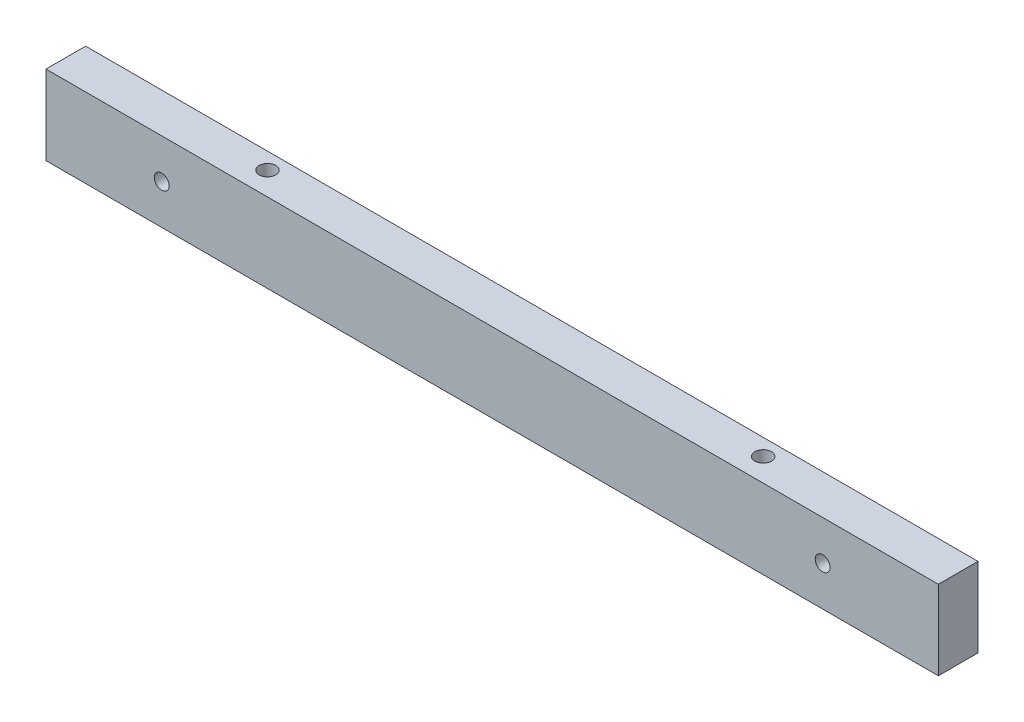
from build123d import *

# Parameters (mm, degrees)
ESQUISSE1_W             = 639
ESQUISSE1_H             = 48
BOSS_EXTRU_1_DEPTH      = 24
ENL_V_MAT_EXTRU_1_DEPTH = 322.297759096
ESQUISSE3_R             = 4.5
ENL_V_MAT_EXTRU_2_DEPTH = 322.297759096
ESQUISSE5_R             = 5
ENL_V_MAT_EXTRU_4_DEPTH = 324.975693533
ENL_V_MAT_EXTRU_5_DEPTH = 322.297759096


with BuildPart() as part:
    # Esquisse1 → Boss.-Extru.1 (new body)
    with BuildSketch(Plane.XY):
        Rectangle(ESQUISSE1_W, ESQUISSE1_H)
    extrude(amount=BOSS_EXTRU_1_DEPTH)

    # Esquisse2 → Enlèv. mat.-Extru.1 (cut, through all)
    with BuildSketch(Plane.XY.offset(24)):
        Polygon((-319.5, 24), (-271.5, -24), (-319.5, -24), align=None)
        Polygon((319.5, 24), (271.5, -24), (319.5, -24), align=None)
    extrude(amount=-ENL_V_MAT_EXTRU_1_DEPTH, mode=Mode.SUBTRACT)

    # Esquisse3 → Enlèv. mat.-Extru.2 (cut, through all)
    with BuildSketch(Plane.XY.offset(24)):
        with Locations((-200, 0)):
            Circle(ESQUISSE3_R)
        with Locations((200, 0)):
            Circle(ESQUISSE3_R)
    extrude(amount=-ENL_V_MAT_EXTRU_2_DEPTH, mode=Mode.SUBTRACT)

    # Esquisse5 → Enlèv. mat.-Extru.4 (cut, through all)
    with BuildSketch(Plane(origin=(0, 24, 0), x_dir=(1, 0, 0), z_dir=(0, 1, 0))):
        with Locations(Location((-150, -10, 0), (0, 0, 180))):
            Circle(ESQUISSE5_R)
        with Locations(Location((150, -10, 0), (0, 0, 180))):
            Circle(ESQUISSE5_R)
    extrude(amount=-ENL_V_MAT_EXTRU_4_DEPTH, mode=Mode.SUBTRACT)

    # Esquisse6 → Enlèv. mat.-Extru.5 (cut, through all)
    with BuildSketch(Plane(origin=(0, 0, 0), x_dir=(-1, 0, 0), z_dir=(0, 0, -1))):
        Polygon((-270, -25.5), (-270, 24), (-319.5, 24), align=None)
        Polygon((270, -25.5), (319.5, 24), (270, 24), align=None)
    extrude(amount=-ENL_V_MAT_EXTRU_5_DEPTH, mode=Mode.SUBTRACT)


solid = part.part
